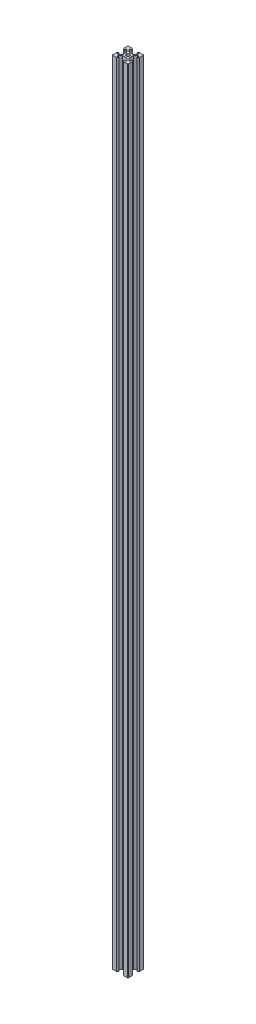
from build123d import *

# Parameters (mm, degrees)
SKETCH1_R           = 2.074585303
BOSS_EXTRUDE2_DEPTH = 1000


with BuildPart() as part:
    # Sketch1 → Boss-Extrude2 (new body)
    with BuildSketch(Plane(origin=(0, 0, 0), x_dir=(1, 0, 0), z_dir=(0, 1, 0))):
        with BuildLine():
            Line((6.1, 12.845), (6.1, 7.149086807))
            Line((6.1, 7.149086807), (3.439339828, 4.5))
            Line((3.439339828, 4.5), (1.8, 4.5))
            Line((1.8, 4.5), (1.8, 6.88))
            Line((1.8, 6.88), (1.46, 6.88))
            Line((1.46, 6.88), (0, 5.42))
            Line((0, 5.42), (0, 0.5))
            ThreePointArc((0, 0.5), (0.146446609, 0.146446609), (0.5, 0))
            Line((0.5, 0), (5.42, 0))
            Line((5.42, 0), (6.875, 1.455))
            Line((6.875, 1.455), (6.875, 1.8))
            Line((6.875, 1.8), (4.5, 1.8))
            Line((4.5, 1.8), (4.5, 3.4393348))
            Line((4.5, 3.4393348), (7.158345795, 6.086117297))
            Line((7.158345795, 6.086117297), (7.144523479, 6.1))
            Line((7.144523479, 6.1), (12.854625295, 6.1))
            Line((12.854625295, 6.1), (12.841221344, 6.086548451))
            Line((12.841221344, 6.086548451), (15.499715, 3.437461644))
            Line((15.499715, 3.437461644), (15.5, 3.437747657))
            Line((15.5, 3.437747657), (15.5, 1.8))
            Line((15.5, 1.8), (13.12, 1.8))
            Line((13.12, 1.8), (13.12, 1.455))
            Line((13.12, 1.455), (14.575, 0))
            Line((14.575, 0), (19.5, 0))
            ThreePointArc((19.5, 0), (19.853553391, 0.146446609), (20, 0.5))
            Line((20, 0.5), (20, 5.42))
            Line((20, 5.42), (18.606904708, 6.88))
            Line((18.606904708, 6.88), (18.2, 6.88))
            Line((18.2, 6.88), (18.2, 4.5))
            Line((18.2, 4.5), (16.558493656, 4.5))
            Line((16.558493656, 4.5), (13.9, 7.149086807))
            Line((13.9, 7.149086807), (13.9, 12.844511469))
            Line((13.9, 12.844511469), (16.558493656, 15.492177728))
            Line((16.558493656, 15.492177728), (16.550703242, 15.5))
            Line((16.550703242, 15.5), (18.2, 15.5))
            Line((18.2, 15.5), (18.2, 13.12))
            Line((18.2, 13.12), (18.534428266, 13.12))
            Line((18.534428266, 13.12), (20, 14.58))
            Line((20, 14.58), (20, 19.5))
            ThreePointArc((20, 19.5), (19.853553391, 19.853553391), (19.5, 20))
            Line((19.5, 20), (14.575, 20))
            Line((14.575, 20), (13.12, 18.545))
            Line((13.12, 18.545), (13.12, 18.2))
            Line((13.12, 18.2), (15.5, 18.2))
            Line((15.5, 18.2), (15.5, 16.555))
            Line((15.5, 16.555), (12.834142613, 13.9))
            Line((12.834142613, 13.9), (7.155, 13.9))
            Line((7.155, 13.9), (4.5, 16.555))
            Line((4.5, 16.555), (4.5, 18.2))
            Line((4.5, 18.2), (6.875, 18.2))
            Line((6.875, 18.2), (6.875, 18.545))
            Line((6.875, 18.545), (5.42, 20))
            Line((5.42, 20), (0.5, 20))
            ThreePointArc((0.5, 20), (0.146446609, 19.853553391), (0, 19.5))
            Line((0, 19.5), (0, 14.58))
            Line((0, 14.58), (1.46, 13.12))
            Line((1.46, 13.12), (1.8, 13.12))
            Line((1.8, 13.12), (1.8, 15.5))
            Line((1.8, 15.5), (3.445, 15.5))
            Line((3.445, 15.5), (3.439339828, 15.494339828))
            Line((3.439339828, 15.494339828), (6.094339828, 12.839339828))
            Line((6.094339828, 12.839339828), (6.1, 12.845))
        make_face()
        with Locations((10, 10)):
            Circle(SKETCH1_R, mode=Mode.SUBTRACT)
    extrude(amount=BOSS_EXTRUDE2_DEPTH)


solid = part.part
